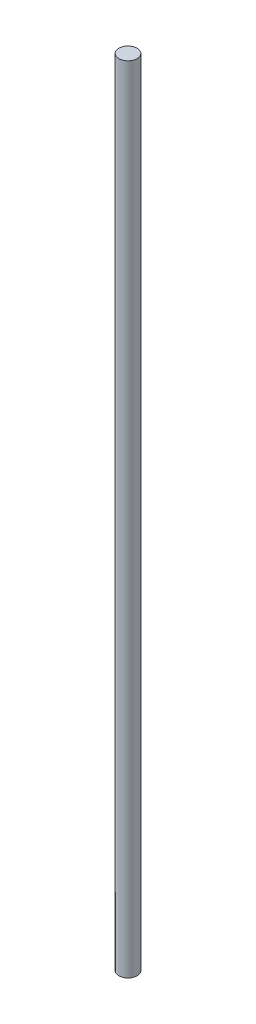
from build123d import *

# Parameters (mm, degrees)
ESBO_O2_R                = 4
RESSALTO_EXTRUS_O1_DEPTH = 175


with BuildPart() as part:
    # Esboço2 → Ressalto-extrusão1 (new, symmetric)
    with BuildSketch(Plane(origin=(0, 0, 0), x_dir=(1, 0, 0), z_dir=(0, 1, 0))):
        with Locations(Location((0, 0, 0), (0, 0, 270))):
            Circle(ESBO_O2_R)
    extrude(amount=RESSALTO_EXTRUS_O1_DEPTH, both=True)


solid = part.part
